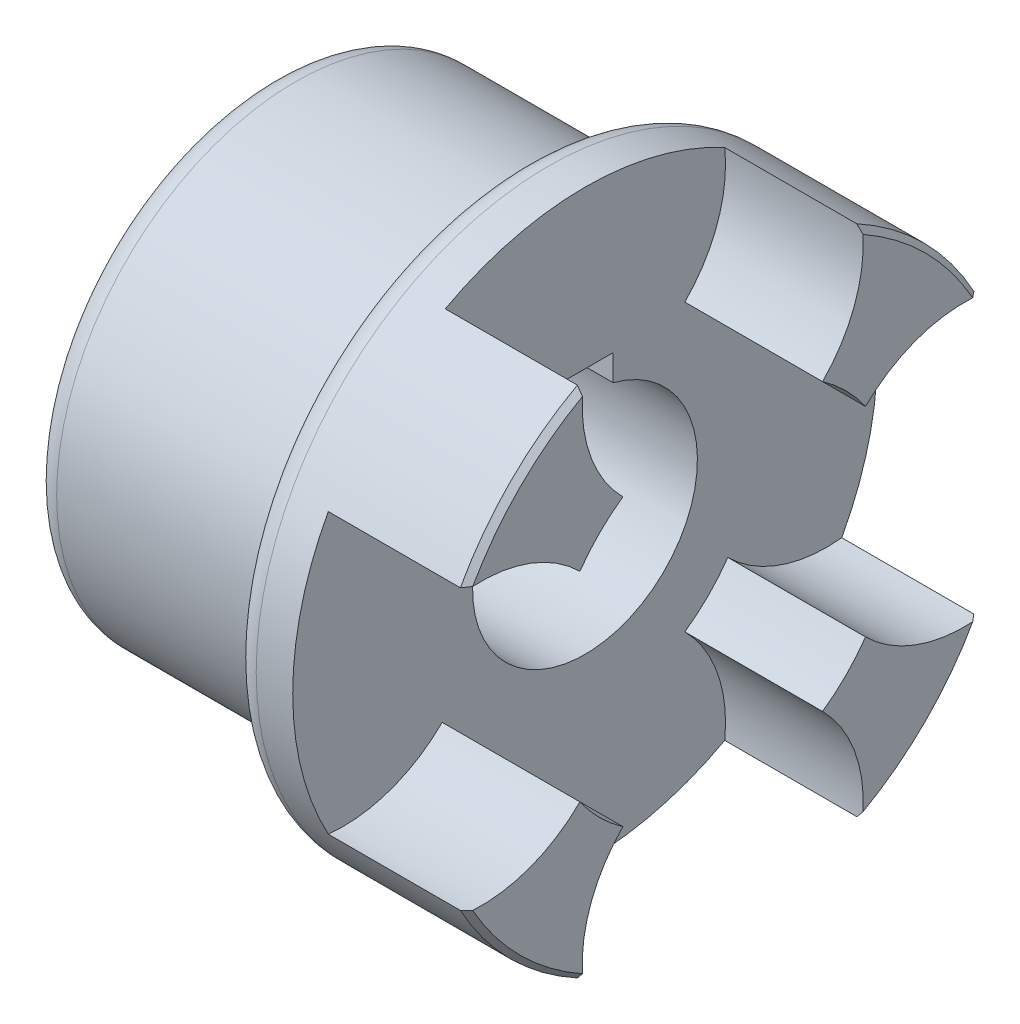
from build123d import *

# Parameters (mm, degrees)
CUT_EXTRUDE_1_DEPTH = 24.5
SKETCH_4_W          = 10
SKETCH_4_H          = 10.423116616
CUT_EXTRUDE_2_DEPTH = 111.376079444


with BuildPart() as part:
    # Эскиз1 → Повернуть1 (revolve)
    with BuildSketch(Plane.XY, mode=Mode.PRIVATE) as revolve_1_sk:
        with BuildLine():
            Line((-70.245087719, -6.642192982), (-69.245087719, -7.642192982))
            Line((-69.245087719, -7.642192982), (9.254912281, -7.642192982))
            Line((9.254912281, -7.642192982), (10.254912281, -6.642192982))
            Line((10.254912281, -6.642192982), (10.254912281, 23.357807018))
            Line((10.254912281, 23.357807018), (9.254912281, 24.357807018))
            Line((9.254912281, 24.357807018), (-20.745087719, 24.357807018))
            ThreePointArc((-20.745087719, 24.357807018), (-23.927068235, 23.039787533), (-25.245087719, 19.857807018))
            Line((-25.245087719, 19.857807018), (-25.245087719, 19.357807018))
            ThreePointArc((-25.245087719, 19.357807018), (-26.563107204, 16.175826502), (-29.745087719, 14.857807018))
            Line((-29.745087719, 14.857807018), (-65.745087719, 14.857807018))
            ThreePointArc((-65.745087719, 14.857807018), (-68.927068235, 13.539787533), (-70.245087719, 10.357807018))
            Line((-70.245087719, 10.357807018), (-70.245087719, -6.642192982))
        make_face()
    revolve(revolve_1_sk.sketch.rotate(Axis((-70.245087719, -27.642192982, 0), (1, 0, 0)), 90), axis=Axis((-70.245087719, -27.642192982, 0), (1, 0, 0)))

    # Эскиз3 → Вырез-Вытянуть1 (cut)
    with BuildSketch(Plane(origin=(10.254912281, 0, 0), x_dir=(0, 0, -1), z_dir=(1, 0, 0))):
        with BuildLine():
            ThreePointArc((-17.761912417, -53.049169727), (0, -95.642192982), (17.761912417, -53.049169727))
            ThreePointArc((17.761912417, -53.049169727), (21.920310217, -49.562503199), (25.406976744, -45.4041054))
            ThreePointArc((25.406976744, -45.4041054), (68, -27.642192982), (25.406976744, -9.880280565))
            ThreePointArc((25.406976744, -9.880280565), (21.920310217, -5.721882766), (17.761912417, -2.235216238))
            ThreePointArc((17.761912417, -2.235216238), (0, 40.357807018), (-17.761912417, -2.235216238))
            ThreePointArc((-17.761912417, -2.235216238), (-21.920310217, -5.721882766), (-25.406976744, -9.880280565))
            ThreePointArc((-25.406976744, -9.880280565), (-68, -27.642192982), (-25.406976744, -45.4041054))
            ThreePointArc((-25.406976744, -45.4041054), (-21.920310217, -49.562503199), (-17.761912417, -53.049169727))
        make_face()
    extrude(amount=-CUT_EXTRUDE_1_DEPTH, mode=Mode.SUBTRACT)

    # Эскиз4 → Вырез-Вытянуть2 (cut, through all)
    with BuildSketch(Plane(origin=(-14.245087719, 0, 0), x_dir=(0, 0, -1), z_dir=(1, 0, 0))):
        with Locations((0, -8.85375129)):
            Rectangle(SKETCH_4_W, SKETCH_4_H)
    extrude(amount=-CUT_EXTRUDE_2_DEPTH, mode=Mode.SUBTRACT)


solid = part.part
